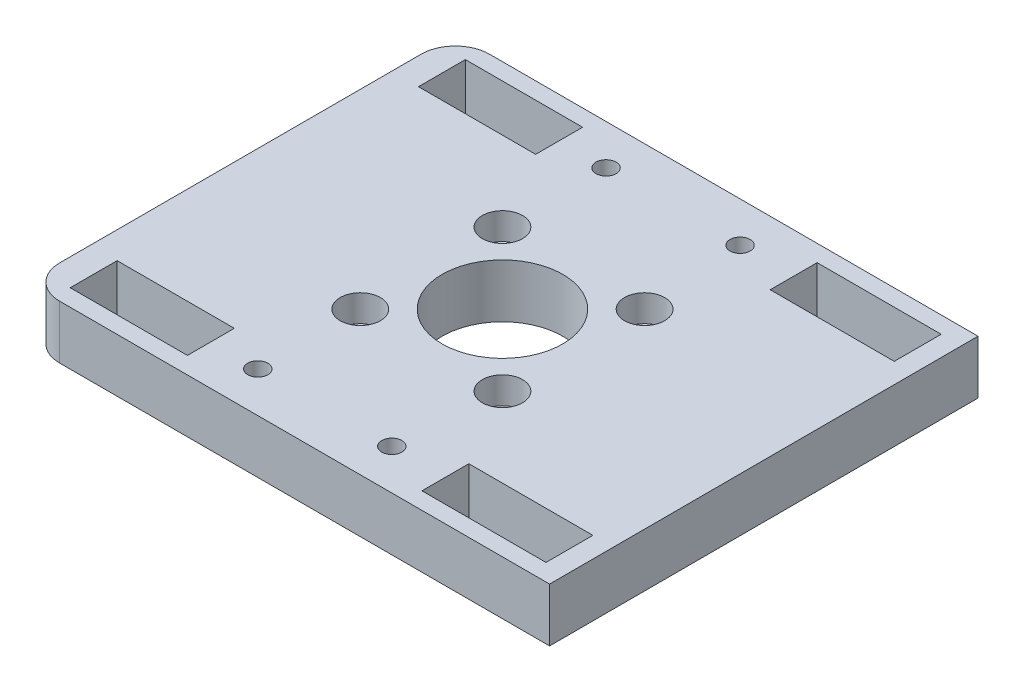
from build123d import *

# Parameters (mm, degrees)
SKETCH1_R           = 9
SKETCH1_R_2         = 1.5
SKETCH1_W           = 17.49
SKETCH1_H           = 7
SKETCH1_W_2         = 18.51
BOSS_EXTRUDE1_DEPTH = 8
SKETCH2_R           = 3
CUT_EXTRUDE1_DEPTH  = 4
SKETCH5_R           = 1.5
CUT_EXTRUDE3_DEPTH  = 52.125968688
SKETCH5_3_R         = 3
SKETCH5_3_R_2       = 1.5
CUT_EXTRUDE4_DEPTH  = 4


with BuildPart() as part:
    # Sketch1 → Boss-Extrude1 (new body)
    with BuildSketch(Plane(origin=(0, 0, 0), x_dir=(1, 0, 0), z_dir=(0, 1, 0))):
        with BuildLine():
            Line((-33.922517503, 31.986083161), (38.983038853, 31.986083161))
            Line((38.983038853, 31.986083161), (39.05091296, -32.013916839))
            Line((39.05091296, -32.013916839), (-34.065012631, -32.013916839))
            ThreePointArc((-34.065012631, -32.013916839), (-37.566569007, -30.563524698), (-39.016961147, -27.061968322))
            Line((-39.016961147, -27.061968322), (-39.016961147, 26.891639518))
            ThreePointArc((-39.016961147, 26.891639518), (-37.52483315, 30.493955165), (-33.922517503, 31.986083161))
        make_face()
        Circle(SKETCH1_R, mode=Mode.SUBTRACT)
        with Locations((10.606601718, 10.606601718)):
            Circle(SKETCH1_R_2, mode=Mode.SUBTRACT)
        with Locations((-10.606601718, 10.606601718)):
            Circle(SKETCH1_R_2, mode=Mode.SUBTRACT)
        with Locations((10.606601718, -10.606601718)):
            Circle(SKETCH1_R_2, mode=Mode.SUBTRACT)
        with Locations((-10.606601718, -10.606601718)):
            Circle(SKETCH1_R_2, mode=Mode.SUBTRACT)
        with Locations((-26.271961147, 25.986083161)):
            Rectangle(SKETCH1_W, SKETCH1_H, mode=Mode.SUBTRACT)
        with Locations((26.728038853, 25.986083161)):
            Rectangle(SKETCH1_W_2, SKETCH1_H, mode=Mode.SUBTRACT)
        with Locations((26.728038853, -25.986083161)):
            Rectangle(SKETCH1_W_2, SKETCH1_H, mode=Mode.SUBTRACT)
        with Locations((-26.271961147, -25.986083161)):
            Rectangle(SKETCH1_W, SKETCH1_H, mode=Mode.SUBTRACT)
    extrude(amount=BOSS_EXTRUDE1_DEPTH)

    # Sketch2 → Cut-Extrude1 (cut)
    with BuildSketch(Plane(origin=(0, 8, 0), x_dir=(1, 0, 0), z_dir=(0, 1, 0))):
        with Locations((10.606601718, 10.606601718)):
            Circle(SKETCH2_R)
        with Locations((10.606601718, -10.606601718)):
            Circle(SKETCH2_R)
        with Locations((-10.606601718, -10.606601718)):
            Circle(SKETCH2_R)
        with Locations((-10.606601718, 10.606601718)):
            Circle(SKETCH2_R)
    extrude(amount=-CUT_EXTRUDE1_DEPTH, mode=Mode.SUBTRACT)

    # Sketch5 → Cut-Extrude3 (cut, through all)
    with BuildSketch(Plane.XZ):
        with Locations((-10.52309756, 25.986083161)):
            Circle(SKETCH5_R)
        with Locations((9.473038853, 25.986083161)):
            Circle(SKETCH5_R)
        with Locations((9.473038853, -25.986083161)):
            Circle(SKETCH5_R)
        with Locations((-10.52309756, -25.986083161)):
            Circle(SKETCH5_R)
    extrude(amount=-CUT_EXTRUDE3_DEPTH, mode=Mode.SUBTRACT)

    # Sketch5<3> → Cut-Extrude4 (cut)
    # profile 1 of 4: a face of its own
    with BuildSketch(Plane.XZ):
        with Locations((-10.52309756, 25.986083161)):
            Circle(SKETCH5_3_R)
        with Locations((-10.52309756, 25.986083161)):
            Circle(SKETCH5_3_R_2, mode=Mode.SUBTRACT)
    # profile 2 of 4: a face of its own
    with BuildSketch(Plane.XZ):
        with Locations((9.473038853, 25.986083161)):
            Circle(SKETCH5_3_R)
        with Locations((9.473038853, 25.986083161)):
            Circle(SKETCH5_3_R_2, mode=Mode.SUBTRACT)
    # profile 3 of 4: a face of its own
    with BuildSketch(Plane.XZ):
        with Locations((9.473038853, -25.986083161)):
            Circle(SKETCH5_3_R)
        with Locations((9.473038853, -25.986083161)):
            Circle(SKETCH5_3_R_2, mode=Mode.SUBTRACT)
    # profile 4 of 4: a face of its own
    with BuildSketch(Plane.XZ):
        with Locations((-10.52309756, -25.986083161)):
            Circle(SKETCH5_3_R)
        with Locations((-10.52309756, -25.986083161)):
            Circle(SKETCH5_3_R_2, mode=Mode.SUBTRACT)
    extrude(amount=-CUT_EXTRUDE4_DEPTH, mode=Mode.SUBTRACT)


solid = part.part
